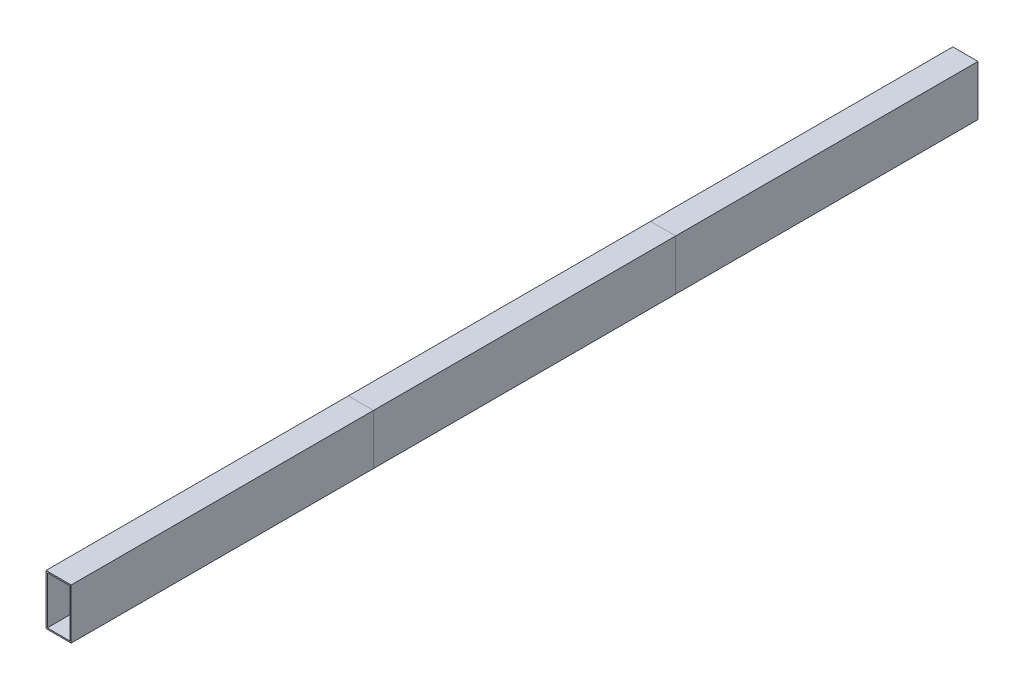
from build123d import *

# Parameters (mm, degrees)
SKETCH_1_W      = 100
SKETCH_1_H      = 200
SKETCH_1_W_2    = 90
SKETCH_1_H_2    = 190
EXTRUDE_1_DEPTH = 1200
EXTRUDE_START   = 1200
SKETCH_1_3_W    = 100
SKETCH_1_3_H    = 200
SKETCH_1_3_W_2  = 90
SKETCH_1_3_H_2  = 190
EXTRUDE_2_DEPTH = 1200
EXTRUDE_START_2 = 2400
SKETCH_1_4_W    = 100
SKETCH_1_4_H    = 200
SKETCH_1_4_W_2  = 90
SKETCH_1_4_H_2  = 190
EXTRUDE_3_DEPTH = 1200


with BuildPart() as part:
    # Эскиз1 → Бобышка-Вытянуть1 (new body)
    with BuildSketch(Plane.XY):
        Rectangle(SKETCH_1_W, SKETCH_1_H)
        Rectangle(SKETCH_1_W_2, SKETCH_1_H_2, mode=Mode.SUBTRACT)
    extrude(amount=EXTRUDE_1_DEPTH)


with BuildPart() as body_2:
    # Эскиз1<3> → Бобышка-Вытянуть2 (new body)
    with BuildSketch(Plane.XY.offset(EXTRUDE_START)):
        Rectangle(SKETCH_1_3_W, SKETCH_1_3_H)
        Rectangle(SKETCH_1_3_W_2, SKETCH_1_3_H_2, mode=Mode.SUBTRACT)
    extrude(amount=EXTRUDE_2_DEPTH)


with BuildPart() as body_3:
    # Эскиз1<4> → Бобышка-Вытянуть3 (new body)
    with BuildSketch(Plane.XY.offset(EXTRUDE_START_2)):
        Rectangle(SKETCH_1_4_W, SKETCH_1_4_H)
        Rectangle(SKETCH_1_4_W_2, SKETCH_1_4_H_2, mode=Mode.SUBTRACT)
    extrude(amount=EXTRUDE_3_DEPTH)


solid = Compound([part.part, body_2.part, body_3.part])
